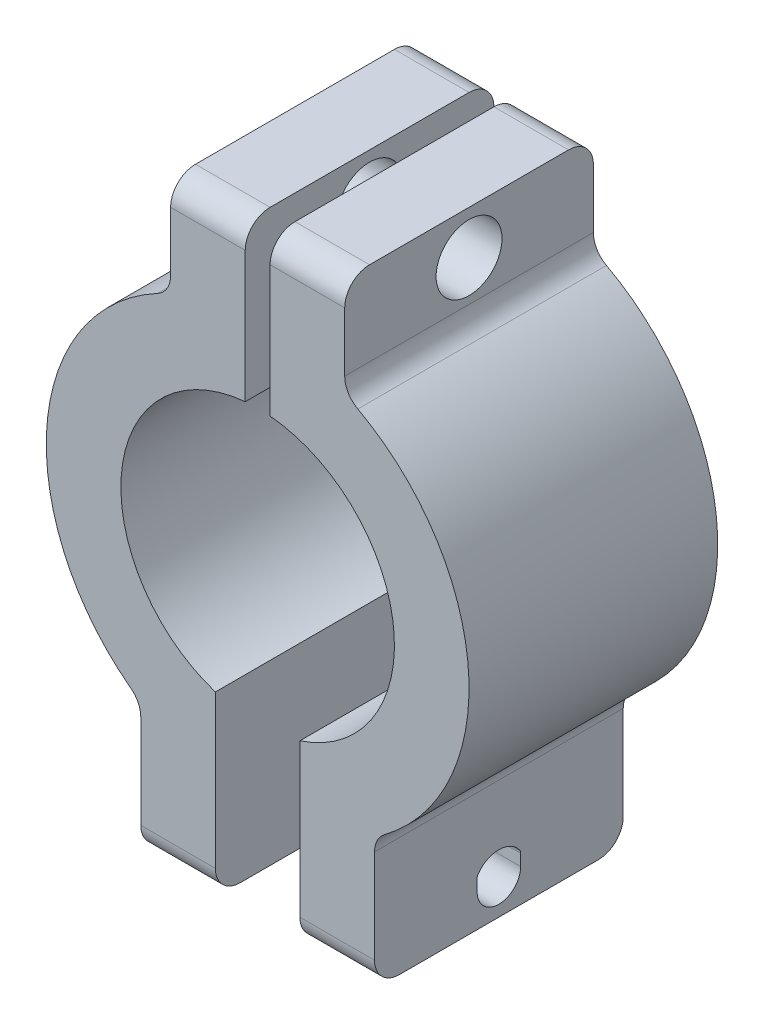
from build123d import *

# Parameters (mm, degrees)
BOSS_EXTRUDE1_DEPTH   = 20
BOSS_EXTRUDE1_2_DEPTH = 20
SKETCH2_R             = 2.65
CUT_EXTRUDE1_DEPTH    = 14
CUT_EXTRUDE3_DEPTH    = 19
FILLET2_R             = 2
FILLET3_R             = 2


with BuildPart() as part:
    # Sketch1 → Boss-Extrude1 (new body)
    with BuildSketch(Plane.XY):
        with BuildLine():
            Line((-1, 23.491933385), (-1, 10.95445115))
            ThreePointArc((-1, 10.95445115), (-10.931569634, 1.225065445), (-3.4, -10.461357464))
            Line((-3.4, -10.461357464), (-3.4, -24.749285698))
            Line((-3.4, -24.749285698), (-9.4, -24.749285698))
            Line((-9.4, -24.749285698), (-9.4, -14.164744968))
            ThreePointArc((-9.4, -14.164744968), (-16.944605122, 1.371261198), (-7, 15.491933385))
            Line((-7, 15.491933385), (-7, 23.491933385))
            Line((-7, 23.491933385), (-1, 23.491933385))
        make_face()
    extrude(amount=BOSS_EXTRUDE1_DEPTH)


with BuildPart() as body_2:
    # Sketch1 → Boss-Extrude1 2 (new body)
    with BuildSketch(Plane.XY):
        with BuildLine():
            Line((3.4, -10.461357464), (3.4, -24.749285698))
            Line((3.4, -24.749285698), (9.4, -24.749285698))
            Line((9.4, -24.749285698), (9.4, -14.164744968))
            ThreePointArc((9.4, -14.164744968), (16.944605122, 1.371261198), (7, 15.491933385))
            Line((7, 15.491933385), (7, 23.491933385))
            Line((7, 23.491933385), (1, 23.491933385))
            Line((1, 23.491933385), (1, 10.95445115))
            ThreePointArc((1, 10.95445115), (10.931569634, 1.225065445), (3.4, -10.461357464))
        make_face()
    extrude(amount=BOSS_EXTRUDE1_2_DEPTH)


with BuildPart() as cut_extrude1_tool:
    # Sketch2 → Cut-Extrude1 (new body)
    with BuildSketch(Plane(origin=(7, 0, 0), x_dir=(0, 0, -1), z_dir=(1, 0, 0))):
        with Locations((-10, 19.991933385)):
            Circle(SKETCH2_R)
    extrude(amount=-CUT_EXTRUDE1_DEPTH)


with BuildPart() as part_1:
    add(part.part)

    # Cut-Extrude1: cut by cut_extrude1_tool
    add(cut_extrude1_tool.part, mode=Mode.SUBTRACT)


with BuildPart() as body_2_1:
    add(body_2.part)

    # Cut-Extrude1: cut by cut_extrude1_tool
    add(cut_extrude1_tool.part, mode=Mode.SUBTRACT)


with BuildPart() as cut_extrude3_tool:
    # Sketch3 → Cut-Extrude3 (new body)
    with BuildSketch(Plane(origin=(9.4, 0, 0), x_dir=(0, 0, -1), z_dir=(1, 0, 0))):
        with BuildLine():
            Line((-11.75, -22.099285698), (-11.75, -21.182770559))
            ThreePointArc((-11.75, -21.182770559), (-11.725190963, -21.027227805), (-11.653225806, -20.887120514))
            ThreePointArc((-11.653225806, -20.887120514), (-10, -20.049285698), (-8.346774194, -20.887120514))
            ThreePointArc((-8.346774194, -20.887120514), (-8.274809037, -21.027227805), (-8.25, -21.182770559))
            Line((-8.25, -21.182770559), (-8.25, -22.099285698))
            ThreePointArc((-8.25, -22.099285698), (-10, -23.849285698), (-11.75, -22.099285698))
        make_face()
    extrude(amount=-CUT_EXTRUDE3_DEPTH)


with BuildPart() as part_2:
    add(part_1.part)

    # Cut-Extrude3: cut by cut_extrude3_tool
    add(cut_extrude3_tool.part, mode=Mode.SUBTRACT)

    # Fillet3
    fillet3_edges = [part_2.edges().sort_by_distance(p)[0] for p in [
        (-4, 23.491933385, 0),
        (-4, 23.491933385, 20),
        (-9.4, -14.164744968, 10),
        (-7, 15.491933385, 10),
        (-6.4, -24.749285698, 20),
        (-6.4, -24.749285698, 0),
    ]]
    fillet(fillet3_edges, radius=FILLET3_R)


with BuildPart() as body_2_2:
    add(body_2_1.part)

    # Cut-Extrude3: cut by cut_extrude3_tool
    add(cut_extrude3_tool.part, mode=Mode.SUBTRACT)

    # Fillet2
    fillet2_edges = [body_2_2.edges().sort_by_distance(p)[0] for p in [
        (6.4, -24.749285698, 0),
        (6.4, -24.749285698, 20),
        (7, 15.491933385, 10),
        (9.4, -14.164744968, 10),
        (4, 23.491933385, 20),
        (4, 23.491933385, 0),
    ]]
    fillet(fillet2_edges, radius=FILLET2_R)


solid = Compound([part_2.part, body_2_2.part])
